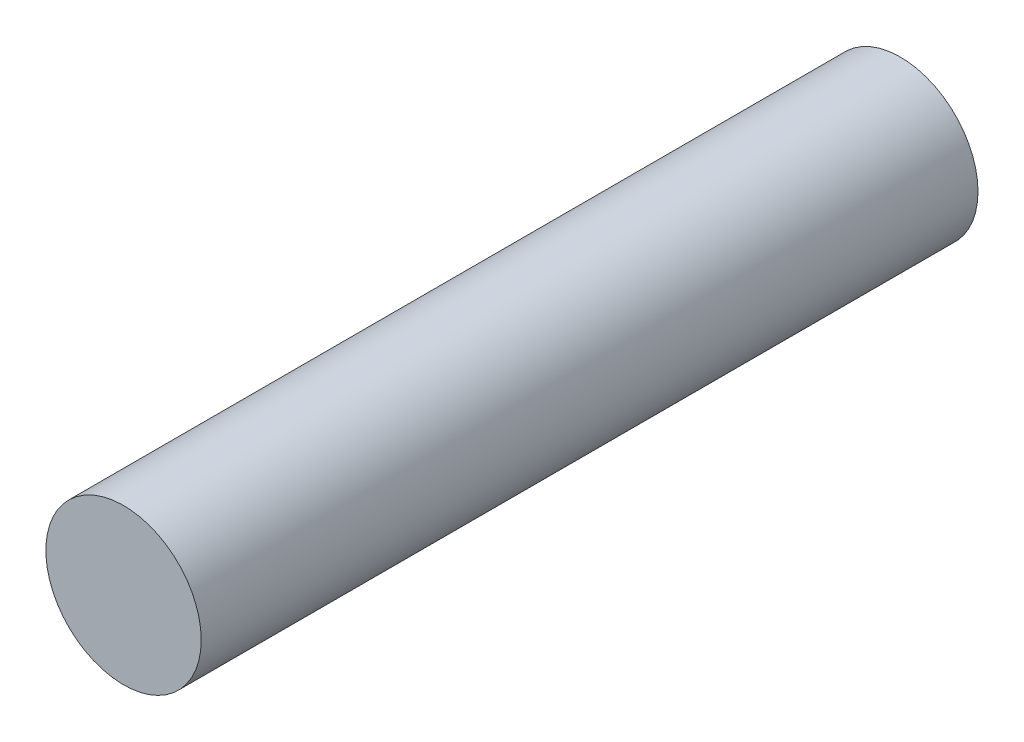
from build123d import *

# Parameters (mm, degrees)
SKETCH_1_R      = 1.8
EXTRUDE_1_DEPTH = 18


with BuildPart() as part:
    # 草图1 → 凸台-拉伸1 (new body)
    with BuildSketch(Plane.XY):
        Circle(SKETCH_1_R)
    extrude(amount=EXTRUDE_1_DEPTH)


solid = part.part
